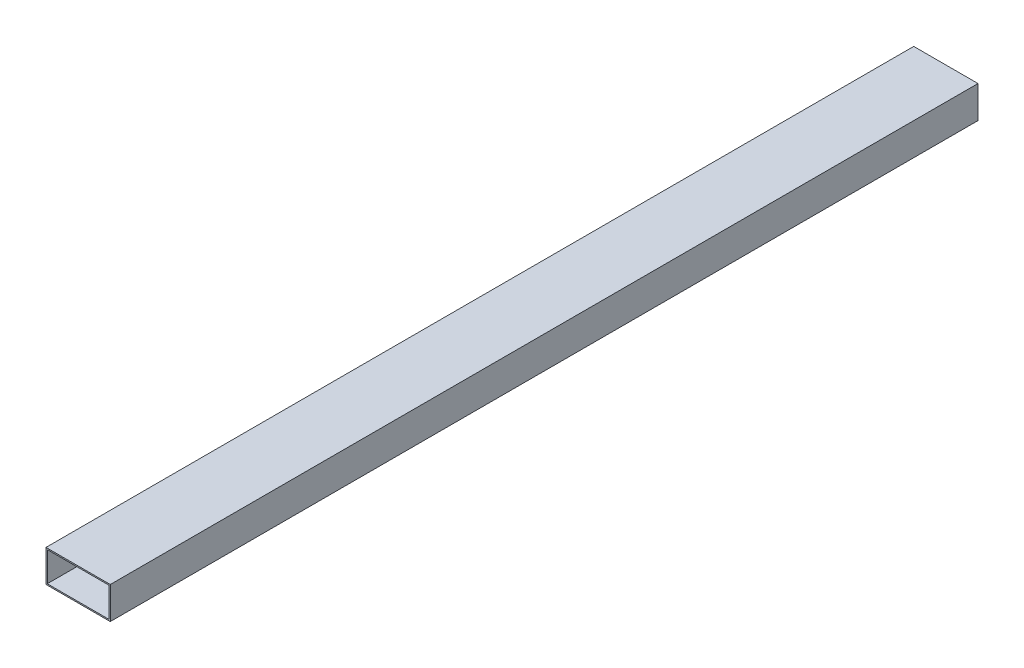
from build123d import *

# Parameters (mm, degrees)
CROQUIS1_W              = 200
CROQUIS1_H              = 100
CROQUIS1_W_2            = 192
CROQUIS1_H_2            = 92
SALIENTE_EXTRUIR1_DEPTH = 2700


with BuildPart() as part:
    # Croquis1 → Saliente-Extruir1 (new body)
    with BuildSketch(Plane.XY):
        with Locations((-7.863012306, -18.62925801)):
            Rectangle(CROQUIS1_W, CROQUIS1_H)
        with Locations((-7.863012306, -18.62925801)):
            Rectangle(CROQUIS1_W_2, CROQUIS1_H_2, mode=Mode.SUBTRACT)
    extrude(amount=SALIENTE_EXTRUIR1_DEPTH)


solid = part.part
